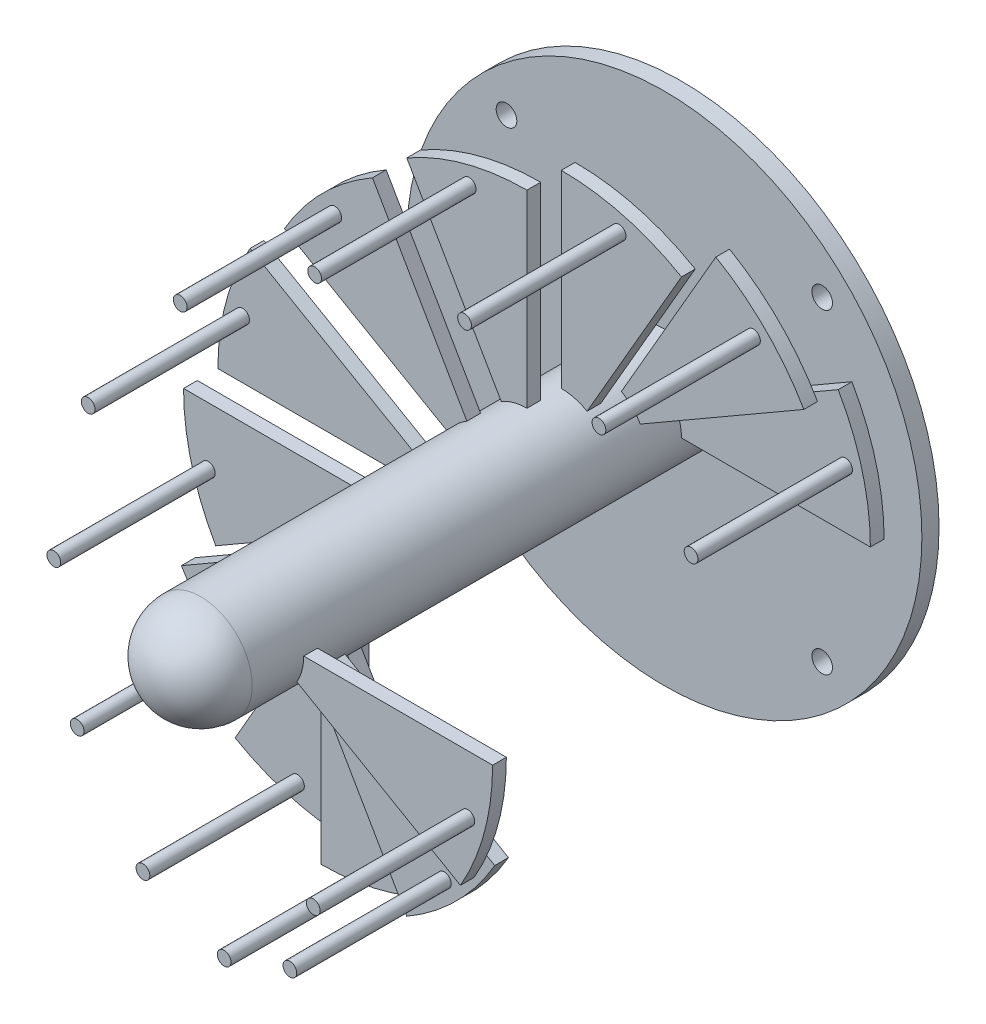
from build123d import *

# Parameters (mm, degrees)
SKETCH_1_R          = 150
EXTRUDE_1_DEPTH     = 10
SKETCH_2_R          = 30
EXTRUDE_2_DEPTH     = 280
EXTRUDE_3_DEPTH     = 8
EXTRUDE_4_DEPTH     = 8
EXTRUDE_5_DEPTH     = 8
EXTRUDE_6_DEPTH     = 8
EXTRUDE_7_DEPTH     = 8
EXTRUDE_8_DEPTH     = 8
EXTRUDE_9_DEPTH     = 8
EXTRUDE_10_DEPTH    = 8
EXTRUDE_11_DEPTH    = 8
EXTRUDE_12_DEPTH    = 8
EXTRUDE_13_DEPTH    = 8
EXTRUDE_14_DEPTH    = 8
SKETCH_16_R         = 4
EXTRUDE_15_DEPTH    = 92
SKETCH_17_R         = 4
EXTRUDE_16_DEPTH    = 92
SKETCH_18_R         = 4
EXTRUDE_17_DEPTH    = 92
SKETCH_19_R         = 4
EXTRUDE_18_DEPTH    = 92
SKETCH_20_R         = 4
EXTRUDE_19_DEPTH    = 92
SKETCH_21_R         = 4
EXTRUDE_20_DEPTH    = 92
SKETCH_22_R         = 4
EXTRUDE_21_DEPTH    = 92
SKETCH_23_R         = 4
EXTRUDE_22_DEPTH    = 92
SKETCH_24_R         = 4
EXTRUDE_23_DEPTH    = 92
SKETCH_25_R         = 4
EXTRUDE_24_DEPTH    = 92
SKETCH_26_R         = 4
EXTRUDE_25_DEPTH    = 92
SKETCH_27_R         = 4
EXTRUDE_26_DEPTH    = 92
SKETCH_28_R         = 10
CUT_EXTRUDE_1_DEPTH = 10.5
SKETCH_29_R         = 6
CUT_EXTRUDE_2_DEPTH = 10.5


with BuildPart() as part:
    # 草图1 → 凸台-拉伸1 (new body)
    with BuildSketch(Plane.XY):
        Circle(SKETCH_1_R)
    extrude(amount=EXTRUDE_1_DEPTH)

    # 草图2 → 凸台-拉伸2 (add)
    with BuildSketch(Plane.XY):
        Circle(SKETCH_2_R)
    extrude(amount=EXTRUDE_2_DEPTH)

    # 草图3 → 旋转1 (revolve)
    with BuildSketch(Plane(origin=(0, 0, 0), x_dir=(1, 0, 0), z_dir=(0, 1, 0))):
        with BuildLine():
            Line((0, -280), (30, -280))
            ThreePointArc((30, -280), (21.2132, -301.2132), (0, -310))
            Line((0, -310), (0, -280))
        make_face()
    revolve(axis=Axis((0, 0, 270), (0, 0, 1)))

    # 草图4 → 凸台-拉伸3 (add)
    with BuildSketch(Plane.XY.offset(22)):
        with BuildLine():
            Line((121.24355653, 70), (17.320508076, 10))
            ThreePointArc((17.320508076, 10), (19.318516526, 5.176380902), (20, 0))
            Line((20, 0), (140, 0))
            ThreePointArc((140, 0), (135.22961568, 36.234666314), (121.24355653, 70))
        make_face()
    extrude(amount=EXTRUDE_3_DEPTH)

    # 草图5 → 凸台-拉伸4 (add)
    with BuildSketch(Plane.XY.offset(42)):
        with BuildLine():
            Line((70, 121.24355653), (10, 17.320508076))
            ThreePointArc((10, 17.320508076), (14.142135624, 14.142135624), (17.320508076, 10))
            Line((17.320508076, 10), (121.24355653, 70))
            ThreePointArc((121.24355653, 70), (98.994949366, 98.994949366), (70, 121.24355653))
        make_face()
    extrude(amount=EXTRUDE_4_DEPTH)

    # 草图6 → 凸台-拉伸5 (add)
    with BuildSketch(Plane.XY.offset(62)):
        with BuildLine():
            Line((0, 140), (0, 20))
            ThreePointArc((0, 20), (5.176380902, 19.318516526), (10, 17.320508076))
            Line((10, 17.320508076), (70, 121.24355653))
            ThreePointArc((70, 121.24355653), (36.234666314, 135.22961568), (0, 140))
        make_face()
    extrude(amount=EXTRUDE_5_DEPTH)

    # 草图7 → 凸台-拉伸6 (add)
    with BuildSketch(Plane.XY.offset(82)):
        with BuildLine():
            Line((-70, 121.24355653), (-10, 17.320508076))
            ThreePointArc((-10, 17.320508076), (-5.176380902, 19.318516526), (0, 20))
            Line((0, 20), (0, 140))
            ThreePointArc((0, 140), (-36.234666314, 135.22961568), (-70, 121.24355653))
        make_face()
    extrude(amount=EXTRUDE_6_DEPTH)

    # 草图8 → 凸台-拉伸7 (add)
    with BuildSketch(Plane.XY.offset(102)):
        with BuildLine():
            Line((-121.24355653, 70), (-17.320508076, 10))
            ThreePointArc((-17.320508076, 10), (-14.142135624, 14.142135624), (-10, 17.320508076))
            Line((-10, 17.320508076), (-70, 121.24355653))
            ThreePointArc((-70, 121.24355653), (-98.994949366, 98.994949366), (-121.24355653, 70))
        make_face()
    extrude(amount=EXTRUDE_7_DEPTH)

    # 草图9 → 凸台-拉伸8 (add)
    with BuildSketch(Plane.XY.offset(122)):
        with BuildLine():
            Line((-140, 0), (-20, 0))
            ThreePointArc((-20, 0), (-19.318516526, 5.176380902), (-17.320508076, 10))
            Line((-17.320508076, 10), (-121.24355653, 70))
            ThreePointArc((-121.24355653, 70), (-135.22961568, 36.234666314), (-140, 0))
        make_face()
    extrude(amount=EXTRUDE_8_DEPTH)

    # 草图10 → 凸台-拉伸9 (add)
    with BuildSketch(Plane.XY.offset(142)):
        with BuildLine():
            Line((-121.24355653, -70), (-17.320508076, -10))
            ThreePointArc((-17.320508076, -10), (-19.318516526, -5.176380902), (-20, 0))
            Line((-20, 0), (-140, 0))
            ThreePointArc((-140, 0), (-135.22961568, -36.234666314), (-121.24355653, -70))
        make_face()
    extrude(amount=EXTRUDE_9_DEPTH)

    # 草图11 → 凸台-拉伸10 (add)
    with BuildSketch(Plane.XY.offset(162)):
        with BuildLine():
            Line((-70, -121.24355653), (-10, -17.320508076))
            ThreePointArc((-10, -17.320508076), (-14.142135624, -14.142135624), (-17.320508076, -10))
            Line((-17.320508076, -10), (-121.24355653, -70))
            ThreePointArc((-121.24355653, -70), (-98.994949366, -98.994949366), (-70, -121.24355653))
        make_face()
    extrude(amount=EXTRUDE_10_DEPTH)

    # 草图12 → 凸台-拉伸11 (add)
    with BuildSketch(Plane.XY.offset(182)):
        with BuildLine():
            Line((0, -140), (0, -20))
            ThreePointArc((0, -20), (-5.176380902, -19.318516526), (-10, -17.320508076))
            Line((-10, -17.320508076), (-70, -121.24355653))
            ThreePointArc((-70, -121.24355653), (-36.234666314, -135.22961568), (0, -140))
        make_face()
    extrude(amount=EXTRUDE_11_DEPTH)

    # 草图13 → 凸台-拉伸12 (add)
    with BuildSketch(Plane.XY.offset(202)):
        with BuildLine():
            Line((70, -121.24355653), (10, -17.320508076))
            ThreePointArc((10, -17.320508076), (5.176380902, -19.318516526), (0, -20))
            Line((0, -20), (0, -140))
            ThreePointArc((0, -140), (36.234666314, -135.22961568), (70, -121.24355653))
        make_face()
    extrude(amount=EXTRUDE_12_DEPTH)

    # 草图14 → 凸台-拉伸13 (add)
    with BuildSketch(Plane.XY.offset(222)):
        with BuildLine():
            Line((121.24355653, -70), (17.320508076, -10))
            ThreePointArc((17.320508076, -10), (14.142135624, -14.142135624), (10, -17.320508076))
            Line((10, -17.320508076), (70, -121.24355653))
            ThreePointArc((70, -121.24355653), (98.994949366, -98.994949366), (121.24355653, -70))
        make_face()
    extrude(amount=EXTRUDE_13_DEPTH)

    # 草图15 → 凸台-拉伸14 (add)
    with BuildSketch(Plane.XY.offset(242)):
        with BuildLine():
            Line((140, 0), (20, 0))
            ThreePointArc((20, 0), (19.318516526, -5.176380902), (17.320508076, -10))
            Line((17.320508076, -10), (121.24355653, -70))
            ThreePointArc((121.24355653, -70), (135.22961568, -36.234666314), (140, 0))
        make_face()
    extrude(amount=EXTRUDE_14_DEPTH)

    # 草图16 → 凸台-拉伸15 (add)
    with BuildSketch(Plane.XY.offset(28)):
        with Locations((125.566, 33.648)):
            Circle(SKETCH_16_R)
    extrude(amount=EXTRUDE_15_DEPTH)

    # 草图17 → 凸台-拉伸16 (add)
    with BuildSketch(Plane.XY.offset(48)):
        with Locations((91.925, 91.925)):
            Circle(SKETCH_17_R)
    extrude(amount=EXTRUDE_16_DEPTH)

    # 草图18 → 凸台-拉伸17 (add)
    with BuildSketch(Plane.XY.offset(68)):
        with Locations((33.648, 125.566)):
            Circle(SKETCH_18_R)
    extrude(amount=EXTRUDE_17_DEPTH)

    # 草图19 → 凸台-拉伸18 (add)
    with BuildSketch(Plane.XY.offset(88)):
        with Locations((-33.648, 125.566)):
            Circle(SKETCH_19_R)
    extrude(amount=EXTRUDE_18_DEPTH)

    # 草图20 → 凸台-拉伸19 (add)
    with BuildSketch(Plane.XY.offset(108)):
        with Locations((-91.925, 91.925)):
            Circle(SKETCH_20_R)
    extrude(amount=EXTRUDE_19_DEPTH)

    # 草图21 → 凸台-拉伸20 (add)
    with BuildSketch(Plane.XY.offset(128)):
        with Locations((-125.566, 33.648)):
            Circle(SKETCH_21_R)
    extrude(amount=EXTRUDE_20_DEPTH)

    # 草图22 → 凸台-拉伸21 (add)
    with BuildSketch(Plane.XY.offset(148)):
        with Locations((-125.566, -33.648)):
            Circle(SKETCH_22_R)
    extrude(amount=EXTRUDE_21_DEPTH)

    # 草图23 → 凸台-拉伸22 (add)
    with BuildSketch(Plane.XY.offset(168)):
        with Locations((-91.925, -91.925)):
            Circle(SKETCH_23_R)
    extrude(amount=EXTRUDE_22_DEPTH)

    # 草图24 → 凸台-拉伸23 (add)
    with BuildSketch(Plane.XY.offset(188)):
        with Locations((-33.648, -125.566)):
            Circle(SKETCH_24_R)
    extrude(amount=EXTRUDE_23_DEPTH)

    # 草图25 → 凸台-拉伸24 (add)
    with BuildSketch(Plane.XY.offset(208)):
        with Locations((33.648, -125.566)):
            Circle(SKETCH_25_R)
    extrude(amount=EXTRUDE_24_DEPTH)

    # 草图26 → 凸台-拉伸25 (add)
    with BuildSketch(Plane.XY.offset(228)):
        with Locations((91.925, -91.925)):
            Circle(SKETCH_26_R)
    extrude(amount=EXTRUDE_25_DEPTH)

    # 草图27 → 凸台-拉伸26 (add)
    with BuildSketch(Plane.XY.offset(248)):
        with Locations((125.566, -33.648)):
            Circle(SKETCH_27_R)
    extrude(amount=EXTRUDE_26_DEPTH)

    # 草图28 → 切除-拉伸1 (cut)
    with BuildSketch(Plane.XY):
        with Locations(Location((100, 0, 0), (0, 0, 180))):
            Circle(SKETCH_28_R)
    extrude(amount=CUT_EXTRUDE_1_DEPTH, mode=Mode.SUBTRACT)

    # 草图29 → 切除-拉伸2 (cut)
    with BuildSketch(Plane.XY):
        with Locations(Location((91.923882, 91.923882, 0), (0, 0, 180))):
            Circle(SKETCH_29_R)
        with Locations(Location((-91.923882, 91.923882, 0), (0, 0, 180))):
            Circle(SKETCH_29_R)
        with Locations(Location((-91.923882, -91.923882, 0), (0, 0, 180))):
            Circle(SKETCH_29_R)
        with Locations(Location((91.923882, -91.923882, 0), (0, 0, 180))):
            Circle(SKETCH_29_R)
    extrude(amount=CUT_EXTRUDE_2_DEPTH, mode=Mode.SUBTRACT)


solid = part.part
